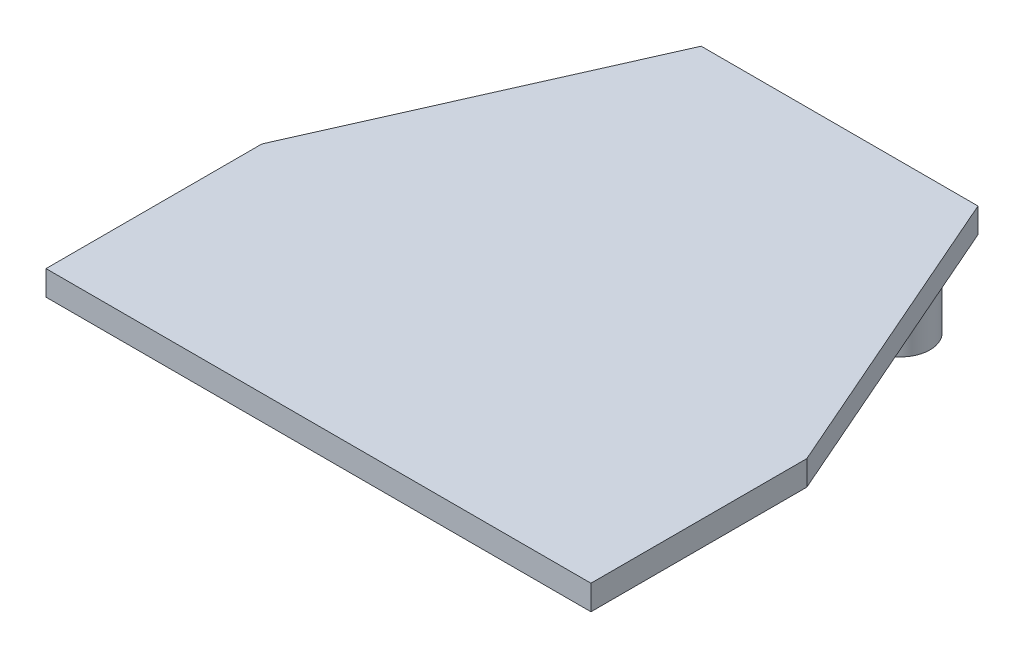
from build123d import *

# Parameters (mm, degrees)
BOSS_EXTRUDE1_DEPTH = 2
SKETCH3_R           = 2.375
SKETCH3_R_2         = 2.372845421
BOSS_EXTRUDE3_DEPTH = 5


with BuildPart() as part:
    # Sketch1 → Boss-Extrude1 (new body)
    with BuildSketch(Plane(origin=(0, 0, 0), x_dir=(1, 0, 0), z_dir=(0, 1, 0))):
        Polygon((-22, 8.714285714), (-22, -8.714285714), (22, -8.714285714), (22, 8.714285714), (11.25, 33.285714286), (-11.1, 33.285714286), align=None)
    extrude(amount=BOSS_EXTRUDE1_DEPTH)

    # Sketch3 → Boss-Extrude3 (add)
    with BuildSketch(Plane.XZ):
        with Locations(Location((-10, -3.285714286, 0), (0, 0, 270))):
            Circle(SKETCH3_R)
        with Locations(Location((-9.991570168, -28.264481029, 0), (0, 0, 270))):
            Circle(SKETCH3_R_2)
        with Locations(Location((10, -28.285714286, 0), (0, 0, 270))):
            Circle(SKETCH3_R)
        with Locations(Location((10, -3.285714286, 0), (0, 0, 270))):
            Circle(SKETCH3_R)
    extrude(amount=BOSS_EXTRUDE3_DEPTH)


solid = part.part
